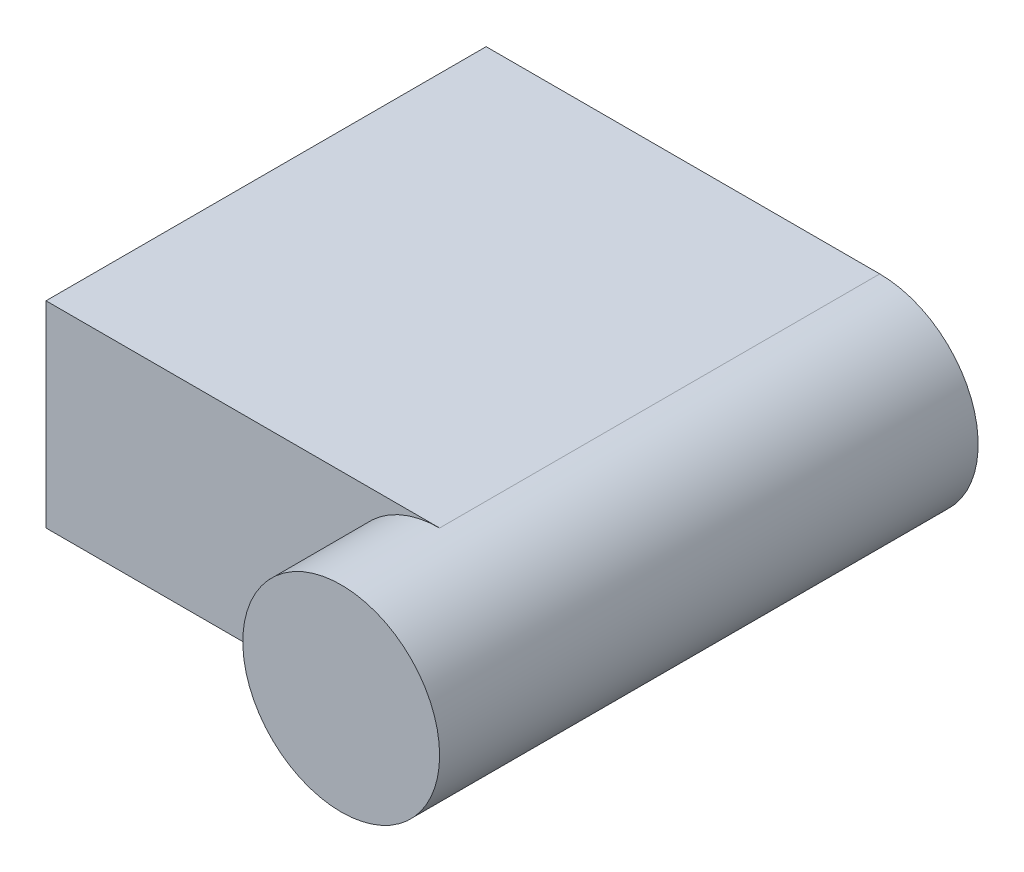
from build123d import *

# Parameters (mm, degrees)
SKETCH_1_W          = 100
SKETCH_1_H          = 20
EXTRUDE_1_DEPTH     = 44.73
SKETCH_3_R          = 10
EXTRUDE_2_DEPTH     = 10
CUT_EXTRUDE_START   = -44.73
CUT_EXTRUDE_1_DEPTH = 44.73


with BuildPart() as part:
    # 草图1 → 凸台-拉伸1 (new body)
    with BuildSketch(Plane.XY):
        with Locations((50, 10)):
            Rectangle(SKETCH_1_W, SKETCH_1_H)
    extrude(amount=EXTRUDE_1_DEPTH)

    # 草图3 → 凸台-拉伸2 (add)
    with BuildSketch(Plane.XY.offset(44.73)):
        with Locations(Location((40, 10, 0), (0, 0, 270))):
            Circle(SKETCH_3_R)
    extrude(amount=EXTRUDE_2_DEPTH)

    # 草图4 → 切除-拉伸1 (cut)
    with BuildSketch(Plane.XY.offset(44.73).offset(CUT_EXTRUDE_START)):
        with BuildLine():
            Line((40, 0), (100, 0))
            Line((100, 0), (100, 20))
            Line((100, 20), (40, 20))
            ThreePointArc((40, 20), (50, 10), (40, 0))
        make_face()
    extrude(amount=CUT_EXTRUDE_1_DEPTH, mode=Mode.SUBTRACT)


solid = part.part
